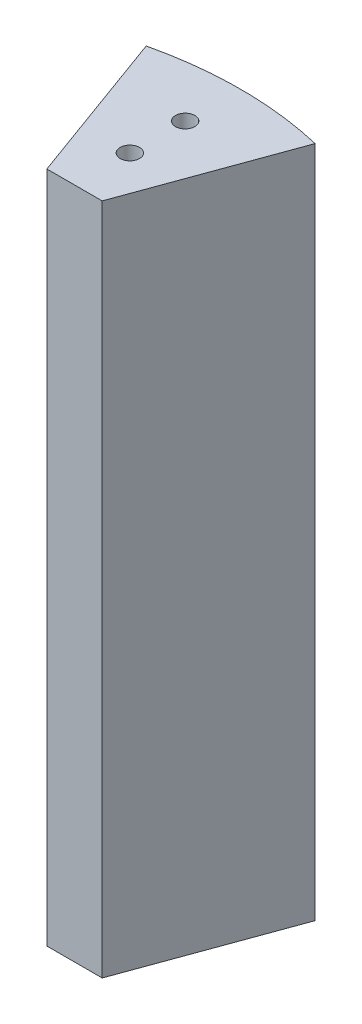
from build123d import *

# Parameters (mm, degrees)
BOSS_EXTRUDE1_DEPTH = 121.65


with BuildPart() as part:
    # Sketch1 → Boss-Extrude1 (new body)
    with BuildSketch(Plane(origin=(0, 0, 0), x_dir=(1, 0, 0), z_dir=(0, 1, 0))):
        with BuildLine():
            Line((-5, 36.5), (0, 36.5))
            Line((0, 36.5), (0, 44.75))
            ThreePointArc((0, 44.75), (-1.75, 46.5), (0, 48.25))
            Line((0, 48.25), (0, 54.75))
            ThreePointArc((0, 54.75), (-1.75, 56.5), (0, 58.25))
            Line((0, 58.25), (0, 66.5))
            ThreePointArc((0, 66.5), (-7.687629304, 66.05414715), (-15.272174355, 64.722567088))
            Line((-15.272174355, 64.722567088), (-5, 36.5))
        make_face()
        with BuildLine():
            Line((0, 44.75), (0, 36.5))
            Line((0, 36.5), (5, 36.5))
            Line((5, 36.5), (15.272174355, 64.722567088))
            ThreePointArc((15.272174355, 64.722567088), (7.687629304, 66.05414715), (0, 66.5))
            Line((0, 66.5), (0, 58.25))
            ThreePointArc((0, 58.25), (1.237436867, 57.737436867), (1.75, 56.5))
            ThreePointArc((1.75, 56.5), (1.237436867, 55.262563133), (0, 54.75))
            Line((0, 54.75), (0, 48.25))
            ThreePointArc((0, 48.25), (1.237436867, 47.737436867), (1.75, 46.5))
            ThreePointArc((1.75, 46.5), (1.237436867, 45.262563133), (0, 44.75))
        make_face()
    extrude(amount=BOSS_EXTRUDE1_DEPTH)


solid = part.part
